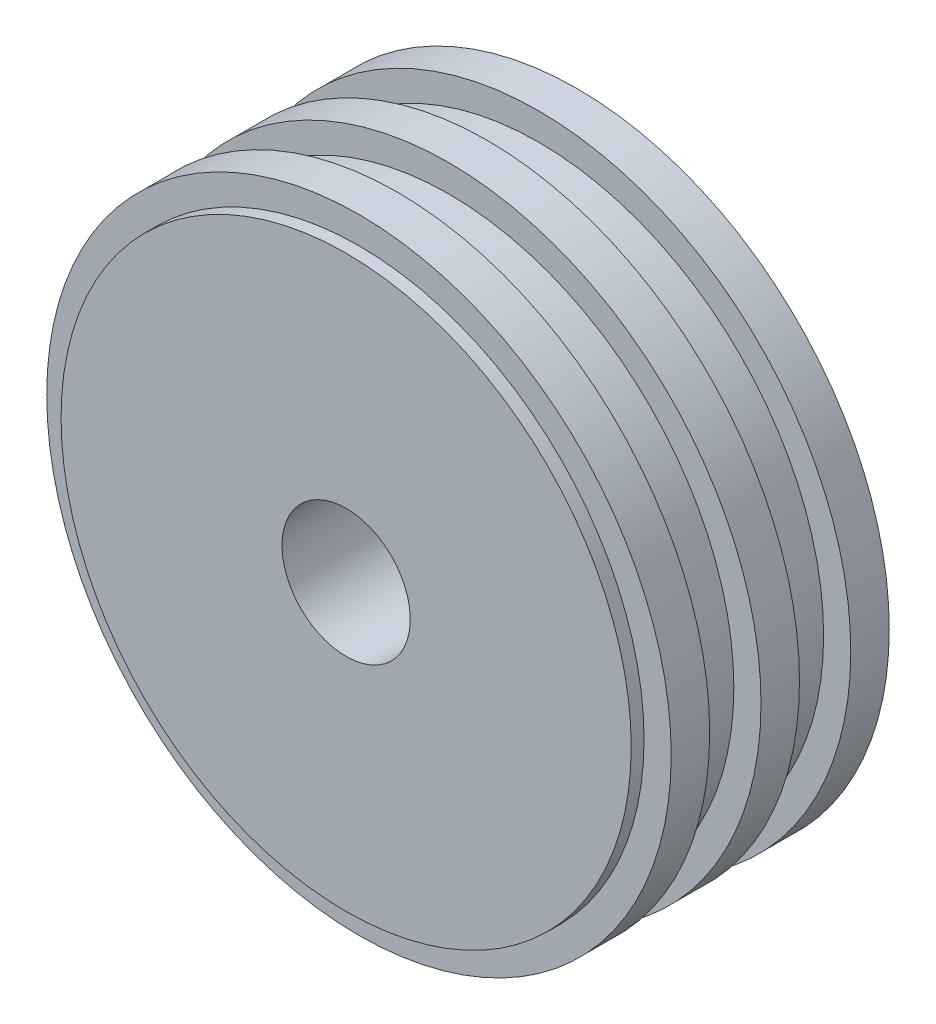
from build123d import *
from build123d.topology import SkipClean

# Parameters (mm, degrees)
SKETCH1_R           = 66.675
SKETCH1_R_2         = 15
BOSS_EXTRUDE3_DEPTH = 57
SKETCH4_R           = 73.025
BOSS_EXTRUDE4_DEPTH = 9
LPATTERN1_COUNT     = 3
LPATTERN1_PITCH     = 21
SKETCH5_R           = 15
CUT_EXTRUDE2_DEPTH  = 500


with BuildPart() as part:
    # Sketch1 → Boss-Extrude3 (new body)
    with BuildSketch(Plane.XY):
        Circle(SKETCH1_R)
        Circle(SKETCH1_R_2, mode=Mode.SUBTRACT)
    extrude(amount=BOSS_EXTRUDE3_DEPTH)

    # Sketch4 → Boss-Extrude4 (add)
    with BuildSketch(Plane(origin=(0, 0, 3), x_dir=(-1, 0, 0), z_dir=(0, 0, -1))):
        Circle(SKETCH4_R)
    boss_extrude4 = extrude(amount=-BOSS_EXTRUDE4_DEPTH)

    # LPattern1: Boss-Extrude4 ×3
    with Locations(*[(0, 0, i * LPATTERN1_PITCH) for i in range(1, LPATTERN1_COUNT)]):
        add(boss_extrude4)

    # Sketch5 → Cut-Extrude2 (cut, symmetric)
    with SkipClean():  # the faces are left unmerged after this step: merging them gives an invalid solid
        with BuildSketch(Plane(origin=(0, 0, 0), x_dir=(-1, 0, 0), z_dir=(0, 0, -1))):
            Circle(SKETCH5_R)
        extrude(amount=CUT_EXTRUDE2_DEPTH, both=True, mode=Mode.SUBTRACT)
    add(part.part.scale(1), mode=Mode.REPLACE)  # the faces are merged on a copy


solid = part.part
